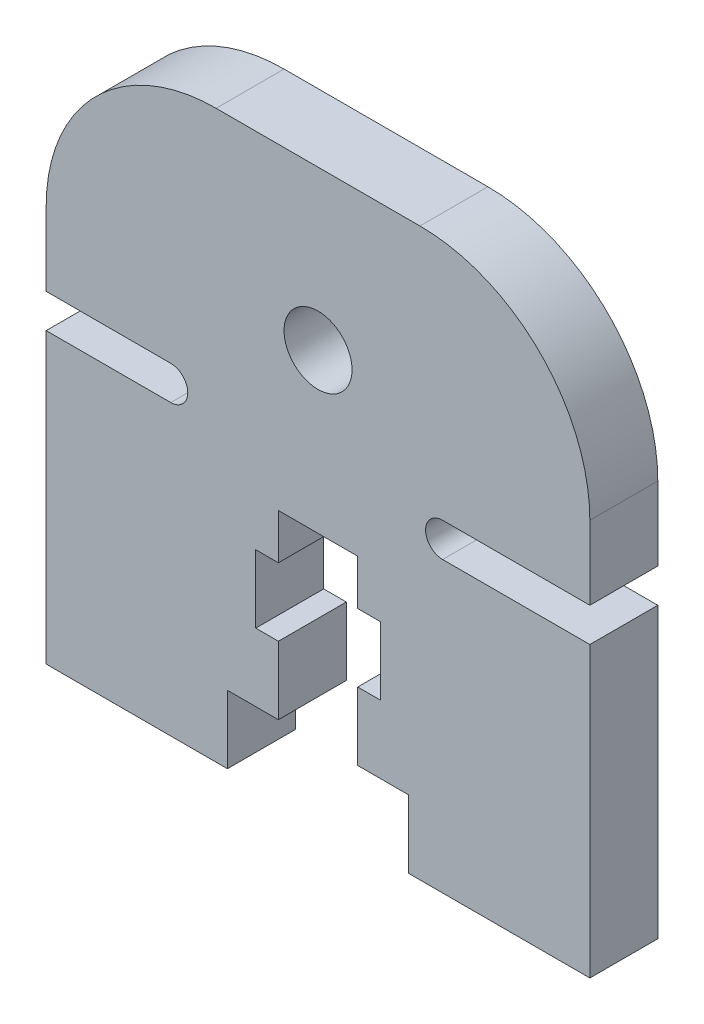
from build123d import *

# Parameters (mm, degrees)
ESQUISSE1_W             = 24
ESQUISSE1_H             = 25
BOSS_EXTRU_1_DEPTH      = 3
CONG_3_R                = 7.5
ENL_V_MAT_EXTRU_1_REACH = 36.785
ESQUISSE2_R             = 1.5
ENL_V_MAT_EXTRU_2_REACH = 36.785
ESQUISSE3_W             = 8
ESQUISSE3_H             = 3
ENL_V_MAT_EXTRU_3_REACH = 36.785
ESQUISSE4_W             = 5.5
ESQUISSE4_H             = 3
ENL_V_START             = -3
ESQUISSE5_W             = 3.5
ESQUISSE5_H             = 11
ENL_V_MAT_EXTRU_4_DEPTH = 3
ENL_V_MAT_EXTRU_5_REACH = 36.785
ENL_V_MAT_EXTRU_6_REACH = 36.785


with BuildPart() as part:
    # Esquisse1 → Boss.-Extru.1 (new body)
    with BuildSketch(Plane.XY):
        with Locations((12, 12.5)):
            Rectangle(ESQUISSE1_W, ESQUISSE1_H)
    extrude(amount=BOSS_EXTRU_1_DEPTH)

    # Congé3
    cong_3_edges = [part.edges().sort_by_distance(p)[0] for p in [
        (0, 25, 1.5),
        (24, 25, 1.5),
    ]]
    fillet(cong_3_edges, radius=CONG_3_R)

    # Esquisse2 → Enlèv. mat.-Extru.1 (cut, up to next)
    with BuildSketch(Plane.XY.offset(3), mode=Mode.PRIVATE) as enl_v_mat_extru_1_sk1:
        with Locations((12, 18)):
            Circle(ESQUISSE2_R)
    enl_v_mat_extru_1_tool1 = extrude(enl_v_mat_extru_1_sk1.sketch, amount=-ENL_V_MAT_EXTRU_1_REACH, mode=Mode.PRIVATE) & part.part
    add(enl_v_mat_extru_1_tool1.solids().sort_by_distance((12, 18, 3))[0], mode=Mode.SUBTRACT)

    # Esquisse3 → Enlèv. mat.-Extru.2 (cut, up to next)
    with BuildSketch(Plane.XY.offset(3), mode=Mode.PRIVATE) as enl_v_mat_extru_2_sk1:
        with Locations((12, 1.5)):
            Rectangle(ESQUISSE3_W, ESQUISSE3_H)
    enl_v_mat_extru_2_tool1 = extrude(enl_v_mat_extru_2_sk1.sketch, amount=-ENL_V_MAT_EXTRU_2_REACH, mode=Mode.PRIVATE) & part.part
    add(enl_v_mat_extru_2_tool1.solids().sort_by_distance((12, 1.5, 3))[0], mode=Mode.SUBTRACT)

    # Esquisse4 → Enlèv. mat.-Extru.3 (cut, up to next)
    with BuildSketch(Plane.XY.offset(3), mode=Mode.PRIVATE) as enl_v_mat_extru_3_sk1:
        with Locations((12, 7.5)):
            Rectangle(ESQUISSE4_W, ESQUISSE4_H)
    enl_v_mat_extru_3_tool1 = extrude(enl_v_mat_extru_3_sk1.sketch, amount=-ENL_V_MAT_EXTRU_3_REACH, mode=Mode.PRIVATE) & part.part
    add(enl_v_mat_extru_3_tool1.solids().sort_by_distance((12, 7.5, 3))[0], mode=Mode.SUBTRACT)

    # Esquisse5 → Enlèv. mat.-Extru.4 (cut)
    with BuildSketch(Plane.XY.offset(3).offset(ENL_V_START)):
        with Locations((12, 5.5)):
            Rectangle(ESQUISSE5_W, ESQUISSE5_H)
    extrude(amount=ENL_V_MAT_EXTRU_4_DEPTH, mode=Mode.SUBTRACT)

    # Esquisse6 → Enlèv. mat.-Extru.5 (cut, up to next)
    with BuildSketch(Plane.XY.offset(3), mode=Mode.PRIVATE) as enl_v_mat_extru_5_sk1:
        with BuildLine():
            Line((17.5, 14.25), (30.5, 14.25))
            ThreePointArc((30.5, 14.25), (31.25, 13.5), (30.5, 12.75))
            Line((30.5, 12.75), (17.5, 12.75))
            ThreePointArc((17.5, 12.75), (16.75, 13.5), (17.5, 14.25))
        make_face()
    enl_v_mat_extru_5_tool1 = extrude(enl_v_mat_extru_5_sk1.sketch, amount=-ENL_V_MAT_EXTRU_5_REACH, mode=Mode.PRIVATE) & part.part
    add(enl_v_mat_extru_5_tool1.solids().sort_by_distance((24, 13.5, 3))[0], mode=Mode.SUBTRACT)

    # Esquisse7 → Enlèv. mat.-Extru.6 (cut, up to next)
    with BuildSketch(Plane.XY.offset(3), mode=Mode.PRIVATE) as enl_v_mat_extru_6_sk1:
        with BuildLine():
            Line((-5.5, 14.25), (5.5, 14.25))
            ThreePointArc((5.5, 14.25), (6.25, 13.5), (5.5, 12.75))
            Line((5.5, 12.75), (-5.5, 12.75))
            ThreePointArc((-5.5, 12.75), (-6.25, 13.5), (-5.5, 14.25))
        make_face()
    enl_v_mat_extru_6_tool1 = extrude(enl_v_mat_extru_6_sk1.sketch, amount=-ENL_V_MAT_EXTRU_6_REACH, mode=Mode.PRIVATE) & part.part
    add(enl_v_mat_extru_6_tool1.solids().sort_by_distance((0, 13.5, 3))[0], mode=Mode.SUBTRACT)


solid = part.part
